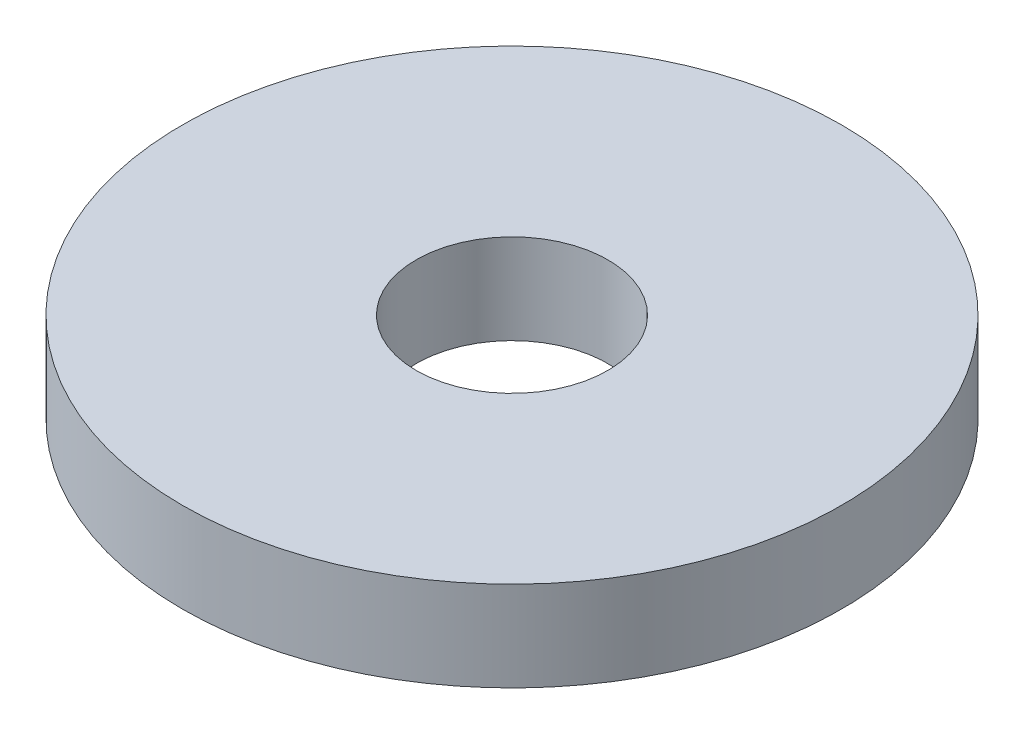
from build123d import *

# Parameters (mm, degrees)
SKETCH1_R           = 5.5
SKETCH1_R_2         = 1.6
BOSS_EXTRUDE1_DEPTH = 1.5


with BuildPart() as part:
    # Sketch1 → Boss-Extrude1 (new body)
    with BuildSketch(Plane(origin=(0, 0, 0), x_dir=(1, 0, 0), z_dir=(0, 1, 0))):
        with Locations(Location((0, 0, 0), (0, 0, 270))):
            Circle(SKETCH1_R)
        with Locations(Location((0, 0, 0), (0, 0, 270))):
            Circle(SKETCH1_R_2, mode=Mode.SUBTRACT)
    extrude(amount=BOSS_EXTRUDE1_DEPTH)


solid = part.part
